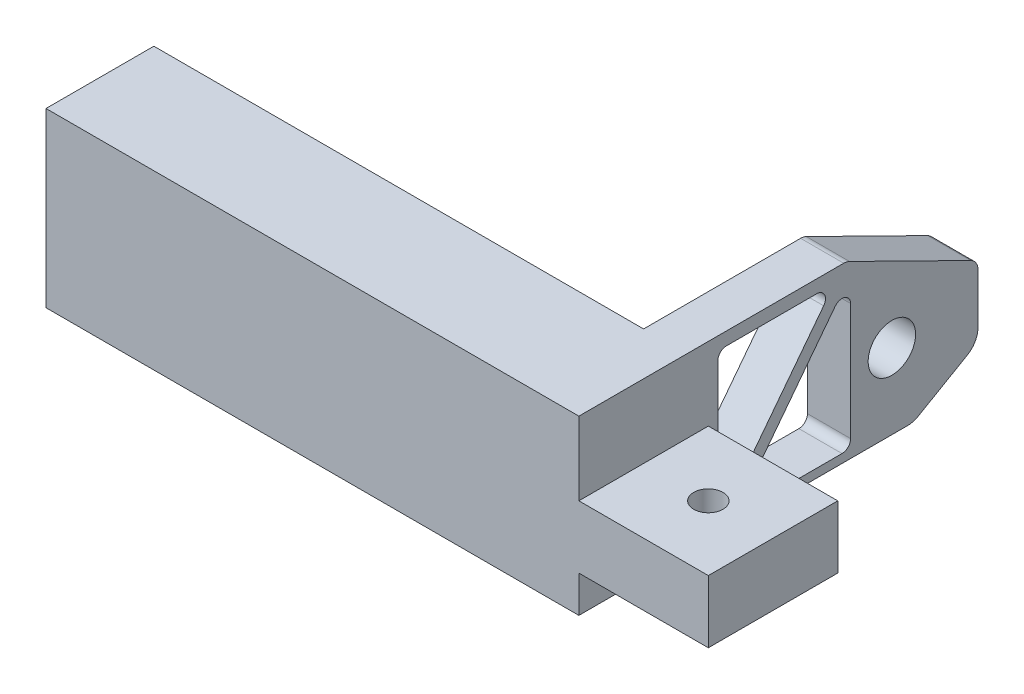
from build123d import *

# Parameters (mm, degrees)
SKETCH1_W             = 92.5
SKETCH1_H             = 40
BOSS_EXTRUDE1_DEPTH   = 10
SKETCH5_R             = 5.5
CUT_EXTRUDE1_DEPTH    = 27
SKETCH6_W             = 30
SKETCH6_H             = 6
BOSS_EXTRUDE5_DEPTH   = 30
SKETCH7_W             = 30
SKETCH7_H             = 30
BOSS_EXTRUDE6_DEPTH   = 8.5
SKETCH4_W             = 25
SKETCH4_H             = 40
SKETCH4_W_2           = 10
SKETCH4_H_2           = 25
BOSS_EXTRUDE7_DEPTH   = 113.5
FILLET1_R             = 3
CHAMFER1_SIZE         = 15
CHAMFER1_SIZE2        = 30.41699103
FILLET3_R             = 3
CHAMFER3_SIZE         = 15
CHAMFER3_SIZE2        = 8.660254038
FILLET7_R             = 5
CUT_EXTRUDE3_DEPTH    = 138.329360826
FILLET8_R             = 2
FILLET9_R             = 2
M8_TAPPED_HOLE1_D     = 6.8
M8_TAPPED_HOLE1_DEPTH = 22.25
M8_TAPPED_HOLE1_TIP   = 2.042926105


with BuildPart() as part:
    # Sketch1 → Boss-Extrude1 (new body)
    with BuildSketch(Plane(origin=(0, 0, 0), x_dir=(0, 0, -1), z_dir=(1, 0, 0))):
        with Locations((10.335365854, 0.129573171)):
            Rectangle(SKETCH1_W, SKETCH1_H)
    extrude(amount=BOSS_EXTRUDE1_DEPTH)

    # Sketch5 → Cut-Extrude1 (cut)
    with BuildSketch(Plane.ZY):
        with Locations((-36.625365854, -2.430426829)):
            Circle(SKETCH5_R)
    extrude(amount=-CUT_EXTRUDE1_DEPTH, mode=Mode.SUBTRACT)

    # Sketch6 → Boss-Extrude5 (add)
    with BuildSketch(Plane(origin=(10, 0, 0), x_dir=(0, 0, -1), z_dir=(1, 0, 0))):
        with Locations((-20.914634146, 0.129573171)):
            Rectangle(SKETCH6_W, SKETCH6_H)
    extrude(amount=BOSS_EXTRUDE5_DEPTH)

    # Sketch7 → Boss-Extrude6 (add)
    with BuildSketch(Plane.XZ.offset(2.870426829)):
        with Locations((25, 20.914634146)):
            Rectangle(SKETCH7_W, SKETCH7_H)
    extrude(amount=BOSS_EXTRUDE6_DEPTH)

    # Sketch4 → Boss-Extrude7 (add)
    with BuildSketch(Plane.ZY):
        with Locations((23.414634146, 0.129573171)):
            Rectangle(SKETCH4_W, SKETCH4_H)
        with Locations((23.414634146, 0.129573171)):
            Rectangle(SKETCH4_W_2, SKETCH4_H_2, mode=Mode.SUBTRACT)
    extrude(amount=BOSS_EXTRUDE7_DEPTH)

    # Fillet1
    fillet1_edges = [part.edges().sort_by_distance(p)[0] for p in [
        (-113.5, 12.629573171, 23.414634146),
        (-113.5, 0.129573171, 18.414634146),
        (-113.5, -12.370426829, 23.414634146),
        (-113.5, 0.129573171, 28.414634146),
    ]]
    fillet(fillet1_edges, radius=FILLET1_R)

    # Chamfer1
    chamfer1_edges = [part.edges().sort_by_distance(p)[0] for p in [
        (5, 20.129573171, -56.585365854),
    ]]
    chamfer1_side = [part.faces().sort_by_distance(p)[0] for p in [
        (5, 0.129573171, -56.585365854),
    ]]
    chamfer(chamfer1_edges, length=CHAMFER1_SIZE, length2=CHAMFER1_SIZE2, reference=chamfer1_side[0])

    # Fillet3
    fillet3_edges = [part.edges().sort_by_distance(p)[0] for p in [
        (5, 20.129573171, -26.168374824),
        (5, 5.129573171, -56.585365854),
    ]]
    fillet(fillet3_edges, radius=FILLET3_R)

    # Chamfer3
    chamfer3_edges = [part.edges().sort_by_distance(p)[0] for p in [
        (5, -19.870426829, -56.585365854),
    ]]
    chamfer3_side = [part.faces().sort_by_distance(p)[0] for p in [
        (-41.568936877, -19.870426829, 15.117291954),
    ]]
    chamfer(chamfer3_edges, length=CHAMFER3_SIZE, length2=CHAMFER3_SIZE2, reference=chamfer3_side[0])

    # Fillet7
    fillet7_edges = [part.edges().sort_by_distance(p)[0] for p in [
        (5, -11.210172791, -56.585365854),
        (5, -19.870426829, -41.585365854),
    ]]
    fillet(fillet7_edges, radius=FILLET7_R)

    # Sketch9 → Cut-Extrude3 (cut, through all)
    with BuildSketch(Plane(origin=(10, 0, 0), x_dir=(0, 0, -1), z_dir=(1, 0, 0))):
        Polygon((-3.714634146, 17.129573171), (23.285365854, 17.129573171), (-3.714634146, -18.047147535), align=None)
        Polygon((0.202838546, -17.870426829), (27.067196026, 17.129573171), (27.067196026, -17.870426829), align=None)
    extrude(amount=-CUT_EXTRUDE3_DEPTH, mode=Mode.SUBTRACT)

    # Fillet8
    fillet8_edges = [part.edges().sort_by_distance(p)[0] for p in [
        (5, -18.047147535, 3.714634146),
        (5, 17.129573171, 3.714634146),
        (5, 17.129573171, -23.285365854),
    ]]
    fillet(fillet8_edges, radius=FILLET8_R)

    # Fillet9
    fillet9_edges = [part.edges().sort_by_distance(p)[0] for p in [
        (5, -17.870426829, -27.067196026),
        (5, -17.870426829, -0.202838546),
        (5, 17.129573171, -27.067196026),
    ]]
    fillet(fillet9_edges, radius=FILLET9_R)

    # M8 Tapped Hole1
    with Locations(Plane(origin=(0, 3.129573171, 0), x_dir=(1, 0, 0), z_dir=(0, 1, 0))):
        with Locations((25, -20.914634146)):
            Hole(M8_TAPPED_HOLE1_D / 2, depth=M8_TAPPED_HOLE1_DEPTH)
            with Locations((0, 0, -(M8_TAPPED_HOLE1_DEPTH + M8_TAPPED_HOLE1_TIP / 2))):  # 118° drill point
                Cone(0, M8_TAPPED_HOLE1_D / 2, M8_TAPPED_HOLE1_TIP, mode=Mode.SUBTRACT)


solid = part.part
